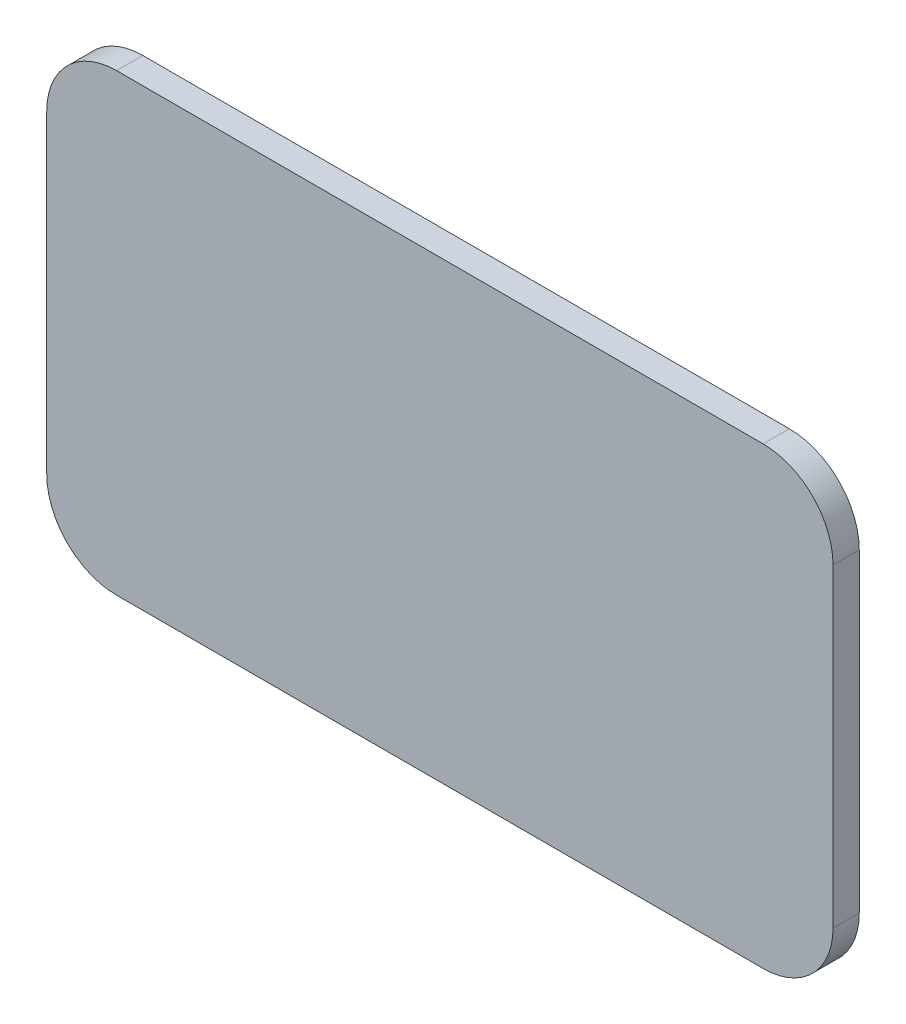
from build123d import *

# Parameters (mm, degrees)
SKETCH1_W           = 45
SKETCH1_H           = 26
BOSS_EXTRUDE1_DEPTH = 1.5
FILLET1_R           = 4


with BuildPart() as part:
    # Sketch1 → Boss-Extrude1 (new body)
    with BuildSketch(Plane.XY):
        with Locations((22.5, -13)):
            Rectangle(SKETCH1_W, SKETCH1_H)
    extrude(amount=BOSS_EXTRUDE1_DEPTH)

    # Fillet1
    fillet1_edges = [part.edges().sort_by_distance(p)[0] for p in [
        (0, 0, 0.75),
        (45, 0, 0.75),
        (45, -26, 0.75),
        (0, -26, 0.75),
    ]]
    fillet(fillet1_edges, radius=FILLET1_R)


solid = part.part
